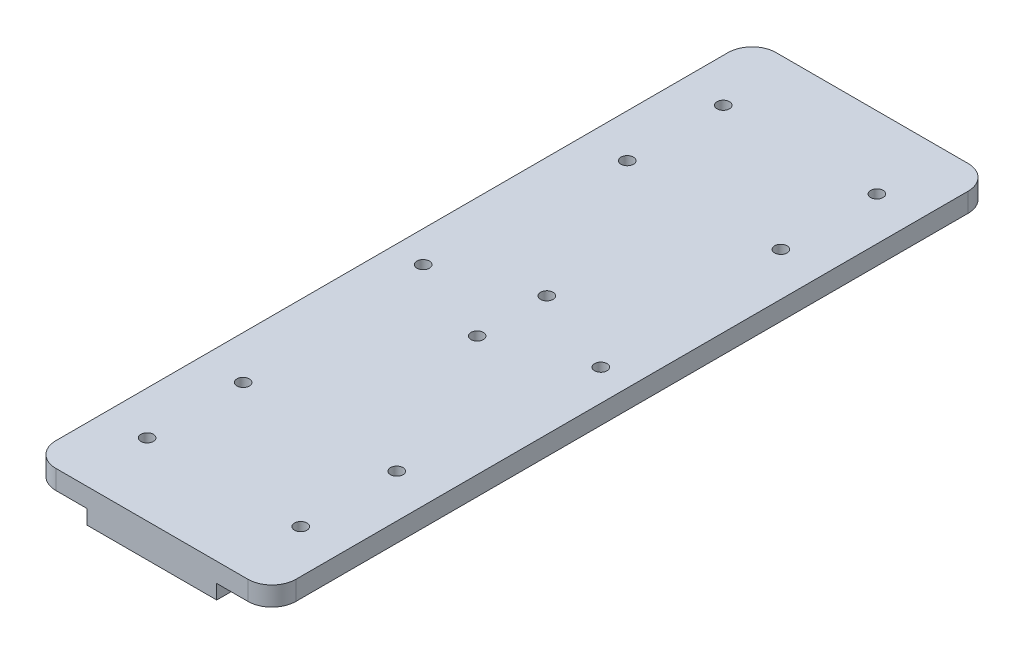
from build123d import *

# Parameters (mm, degrees)
SKETCH_1_W      = 50
SKETCH_1_H      = 150
SKETCH_1_R      = 1.3
EXTRUDE_1_DEPTH = 4
SKETCH_3_W      = 27
SKETCH_3_H      = 62.5
EXTRUDE_2_DEPTH = 3
FILLET_1_R      = 5


with BuildPart() as part:
    # 草图1 → 凸台-拉伸1 (new body)
    with BuildSketch(Plane(origin=(0, 0, 0), x_dir=(1, 0, 0), z_dir=(0, 1, 0))):
        Rectangle(SKETCH_1_W, SKETCH_1_H)
        with Locations(Location((0, 7.25, 0), (0, 0, 270))):
            Circle(SKETCH_1_R, mode=Mode.SUBTRACT)
        with Locations(Location((0, -7.25, 0), (0, 0, 270))):
            Circle(SKETCH_1_R, mode=Mode.SUBTRACT)
        with Locations(Location((-18.5, 0, 0), (0, 0, 270))):
            Circle(SKETCH_1_R, mode=Mode.SUBTRACT)
        with Locations(Location((18.5, 0, 0), (0, 0, 270))):
            Circle(SKETCH_1_R, mode=Mode.SUBTRACT)
        with Locations(Location((-16, -40, 0), (0, 0, 270))):
            Circle(SKETCH_1_R, mode=Mode.SUBTRACT)
        with Locations(Location((16, -40, 0), (0, 0, 270))):
            Circle(SKETCH_1_R, mode=Mode.SUBTRACT)
        with Locations(Location((-16, -60, 0), (0, 0, 270))):
            Circle(SKETCH_1_R, mode=Mode.SUBTRACT)
        with Locations(Location((16, -60, 0), (0, 0, 270))):
            Circle(SKETCH_1_R, mode=Mode.SUBTRACT)
        with Locations(Location((-16, 40, 0), (0, 0, 270))):
            Circle(SKETCH_1_R, mode=Mode.SUBTRACT)
        with Locations(Location((16, 40, 0), (0, 0, 270))):
            Circle(SKETCH_1_R, mode=Mode.SUBTRACT)
        with Locations(Location((-16, 60, 0), (0, 0, 270))):
            Circle(SKETCH_1_R, mode=Mode.SUBTRACT)
        with Locations(Location((16, 60, 0), (0, 0, 270))):
            Circle(SKETCH_1_R, mode=Mode.SUBTRACT)
    extrude(amount=EXTRUDE_1_DEPTH)

    # 草图3 → 凸台-拉伸2 (add)
    with BuildSketch(Plane.XZ):
        with Locations((0, 43.75)):
            Rectangle(SKETCH_3_W, SKETCH_3_H)
        with Locations((0, -43.75)):
            Rectangle(SKETCH_3_W, SKETCH_3_H)
    extrude(amount=EXTRUDE_2_DEPTH)

    # 圆角1
    fillet_1_edges = [part.edges().sort_by_distance(p)[0] for p in [
        (25, 2, 75),
        (-25, 2, 75),
        (-25, 2, -75),
        (25, 2, -75),
    ]]
    fillet(fillet_1_edges, radius=FILLET_1_R)


solid = part.part
